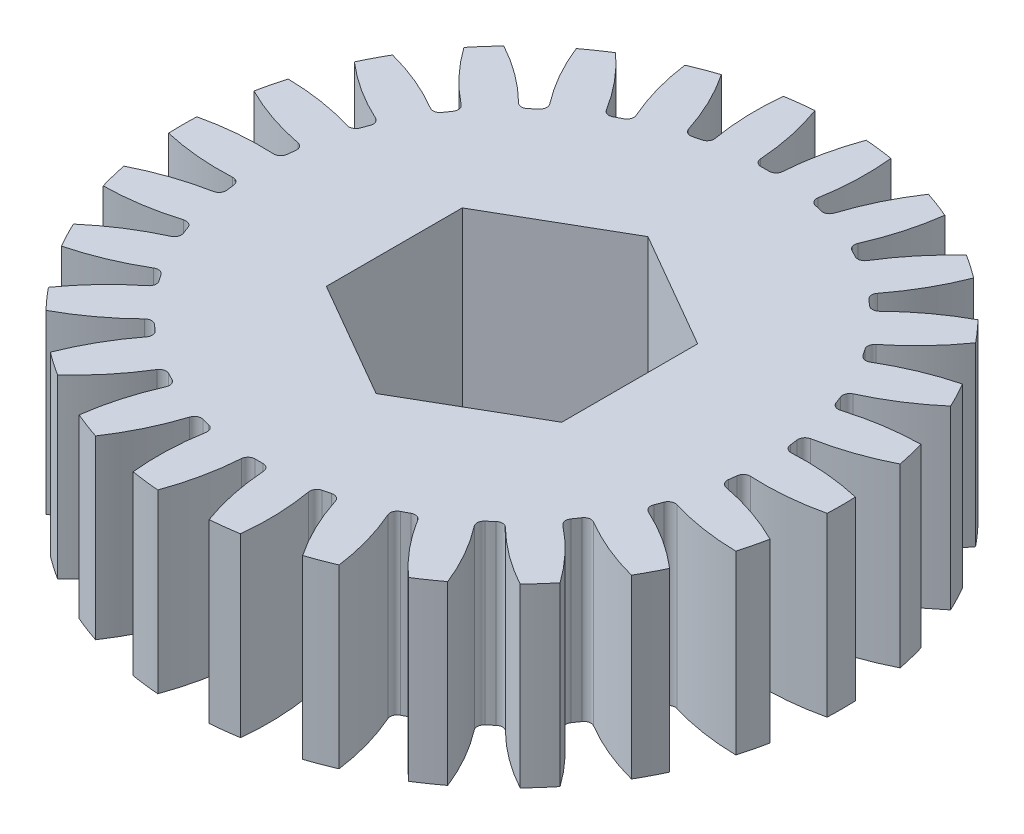
from build123d import *

# Parameters (mm, degrees)
SKETCH1_R                = 17.78
BOSS_EXTRUDE1_DEPTH      = 4.7625
CUT_EXTRUDE1_DEPTH       = 9.525
FILLET1_R                = 0.381
CIRPATTERN1_COUNT        = 26
FILLET1_OF_CIRPATTERN1_R = 0.381
CUT_EXTRUDE2_DEPTH       = 27.852708882


with BuildPart() as part:
    # Sketch1 → Boss-Extrude1 (new, symmetric)
    with BuildSketch(Plane(origin=(0, 0, 0), x_dir=(1, 0, 0), z_dir=(0, 1, 0))):
        with Locations(Location((0, 0, 0), (0, 0, 90))):
            Circle(SKETCH1_R)
    extrude(amount=BOSS_EXTRUDE1_DEPTH, both=True)

    # Sketch2 → Cut-Extrude1 (cut)
    with BuildSketch(Plane(origin=(0, 4.7625, 0), x_dir=(1, 0, 0), z_dir=(0, 1, 0))):
        with BuildLine():
            ThreePointArc((1.383640013, 17.726080794), (0, 17.78), (-1.383640013, 17.726080794))
            ThreePointArc((-1.383640013, 17.726080794), (-0.822219052, 15.714315081), (-0.574700425, 13.640398663))
            ThreePointArc((-0.574700425, 13.640398663), (0, 13.6525), (0.574700425, 13.640398663))
            ThreePointArc((0.574700425, 13.640398663), (0.822219052, 15.714315081), (1.383640013, 17.726080794))
        make_face()
        with BuildLine():
            ThreePointArc((1.899945721, 18.95501797), (0, 19.05), (-1.899945721, 18.95501797))
            ThreePointArc((-1.899945721, 18.95501797), (-1.626763341, 18.346863643), (-1.383640013, 17.726080794))
            ThreePointArc((-1.383640013, 17.726080794), (0, 17.78), (1.383640013, 17.726080794))
            ThreePointArc((1.383640013, 17.726080794), (1.626763341, 18.346863643), (1.899945721, 18.95501797))
        make_face()
    cut_extrude1 = extrude(amount=-CUT_EXTRUDE1_DEPTH, mode=Mode.SUBTRACT)

    # Fillet1
    fillet1_edges = [part.edges().sort_by_distance(p)[0] for p in [
        (-0.574700425, 0, -13.640398663),
        (0.574700425, 0, -13.640398663),
    ]]
    fillet(fillet1_edges, radius=FILLET1_R)

    # CirPattern1: Cut-Extrude1 ×26 about axis
    cirpattern1_axis = Axis((0, 0, 0), (0, 1, 0))
    for i in range(1, CIRPATTERN1_COUNT):
        add(cut_extrude1.rotate(cirpattern1_axis, i * 360 / CIRPATTERN1_COUNT), mode=Mode.SUBTRACT)

    # Fillet1 of CirPattern1
    fillet1_of_cirpattern1_edges = [part.edges().sort_by_distance(p)[0] for p in [
        (-3.822361742, 0, -13.106498654),
        (-2.706360392, 0, -13.381568282),
        (-6.847881288, 0, -11.810896584),
        (-5.830137381, 0, -12.345049792),
        (-9.475426865, 0, -9.828888135),
        (-8.615087976, 0, -10.591081881),
        (-11.552295075, 0, -7.275660434),
        (-10.899360972, 0, -8.221598789),
        (-12.957785885, 0, -4.299597795),
        (-12.550202727, 0, -5.374306259),
        (-13.61021728, 0, -1.073658161),
        (-13.471672317, 0, -2.214678584),
        (-13.471672317, 0, 2.214678584),
        (-13.61021728, 0, 1.073658161),
        (-12.550202727, 0, 5.374306259),
        (-12.957785885, 0, 4.299597795),
        (-10.899360972, 0, 8.221598789),
        (-11.552295075, 0, 7.275660434),
        (-8.615087976, 0, 10.591081881),
        (-9.475426865, 0, 9.828888135),
        (-5.830137381, 0, 12.345049792),
        (-6.847881288, 0, 11.810896584),
        (-2.706360392, 0, 13.381568282),
        (-3.822361742, 0, 13.106498654),
        (0.574700425, 0, 13.640398663),
        (-0.574700425, 0, 13.640398663),
        (3.822361742, 0, 13.106498654),
        (2.706360392, 0, 13.381568282),
        (6.847881288, 0, 11.810896584),
        (5.830137381, 0, 12.345049792),
        (9.475426865, 0, 9.828888135),
        (8.615087976, 0, 10.591081881),
        (11.552295075, 0, 7.275660434),
        (10.899360972, 0, 8.221598789),
        (12.957785885, 0, 4.299597795),
        (12.550202727, 0, 5.374306259),
        (13.61021728, 0, 1.073658161),
        (13.471672317, 0, 2.214678584),
        (13.471672317, 0, -2.214678584),
        (13.61021728, 0, -1.073658161),
        (12.550202727, 0, -5.374306259),
        (12.957785885, 0, -4.299597795),
        (10.899360972, 0, -8.221598789),
        (11.552295075, 0, -7.275660434),
        (8.615087976, 0, -10.591081881),
        (9.475426865, 0, -9.828888135),
        (5.830137381, 0, -12.345049792),
        (6.847881288, 0, -11.810896584),
        (2.706360392, 0, -13.381568282),
        (3.822361742, 0, -13.106498654),
    ]]
    fillet(fillet1_of_cirpattern1_edges, radius=FILLET1_OF_CIRPATTERN1_R)

    # Sketch4 → Cut-Extrude2 (cut, through all)
    with BuildSketch(Plane(origin=(0, 4.7625, 0), x_dir=(1, 0, 0), z_dir=(0, 1, 0))):
        Polygon((0, 7.332348419), (-6.35, 3.666174209), (-6.35, -3.666174209), (0, -7.332348419), (6.35, -3.666174209), (6.35, 3.666174209), align=None)
    extrude(amount=-CUT_EXTRUDE2_DEPTH, mode=Mode.SUBTRACT)


solid = part.part
